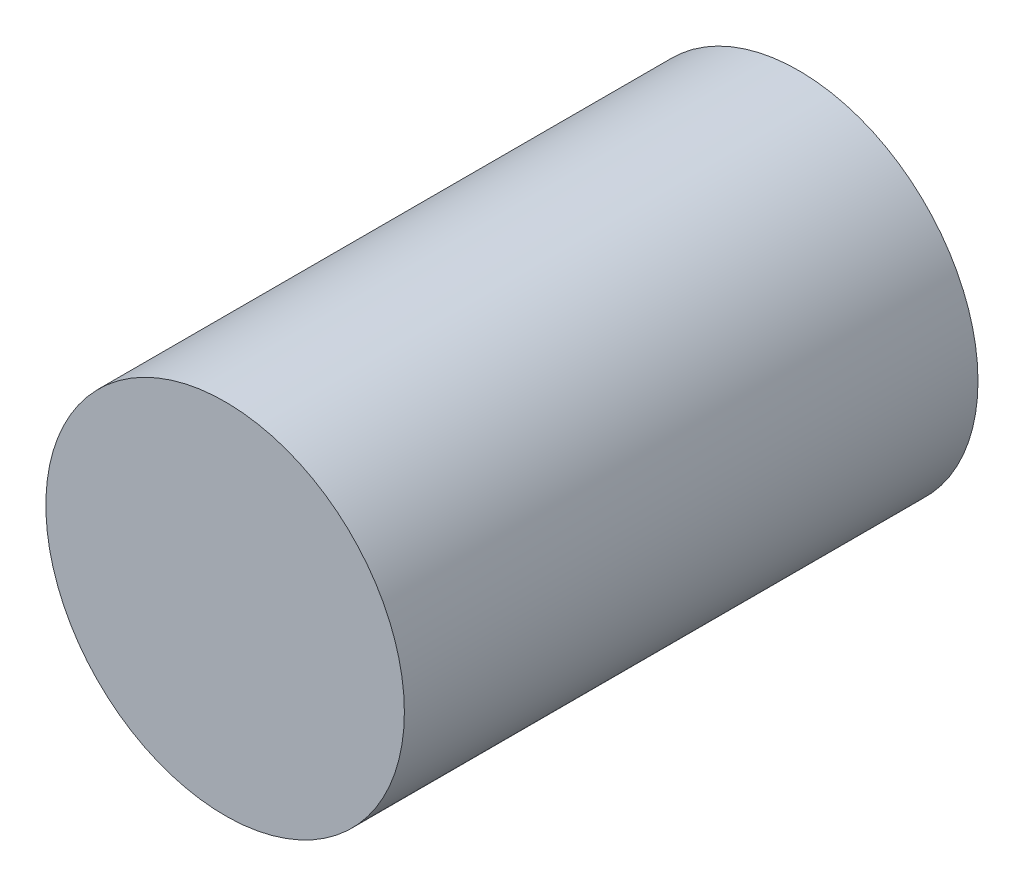
from build123d import *

# Parameters (mm, degrees)
SKETCH1_R           = 1.5875
BOSS_EXTRUDE1_DEPTH = 5.08


with BuildPart() as part:
    # Sketch1 → Boss-Extrude1 (new body)
    with BuildSketch(Plane.XY):
        Circle(SKETCH1_R)
    extrude(amount=BOSS_EXTRUDE1_DEPTH)


solid = part.part
